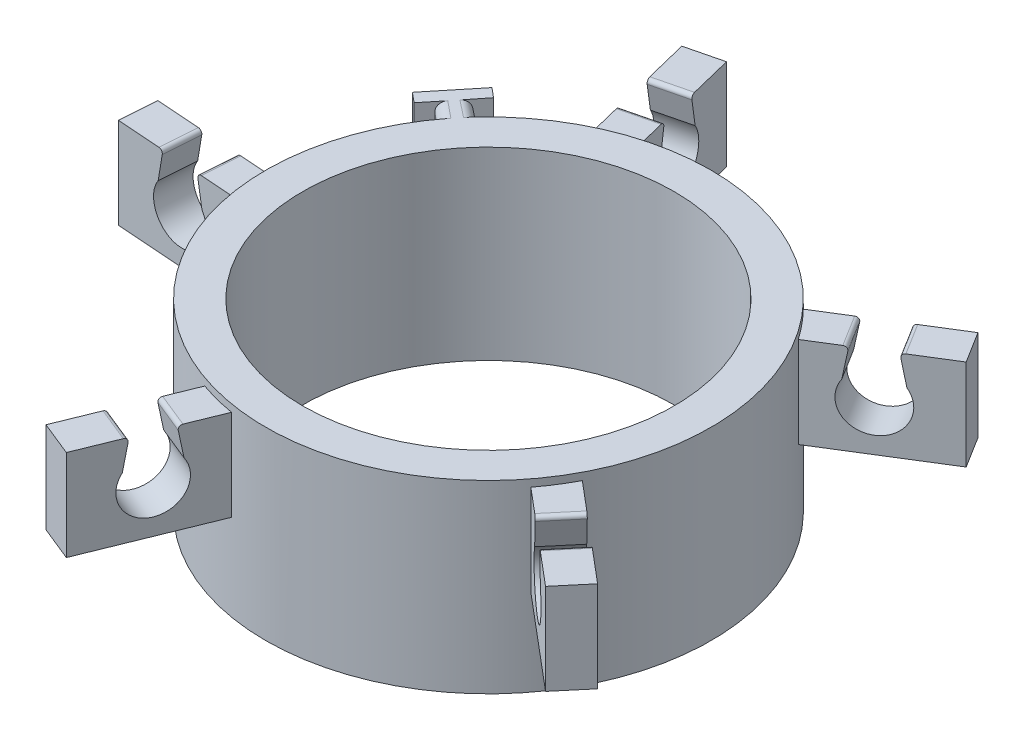
from build123d import *

# Parameters (mm, degrees)
ESQUISSE1_R                      = 12.05
ESQUISSE1_R_2                    = 10.05
BASE_DEPTH                       = 10
BOSS_TIGE_DEPTH                  = 2
CONGE_TIGE_R                     = 0.2
REP_SUPPORT_TIGE_COUNT           = 5
CONGE_TIGE_OF_REP_SUPPORT_TIGE_R = 0.2
BOSS_EXTRU_1_DEPTH               = 3
CONG_1_R                         = 0.5


with BuildPart() as part:
    # Esquisse1 → BASE (new body)
    with BuildSketch(Plane(origin=(0, 0, 0), x_dir=(1, 0, 0), z_dir=(0, 1, 0))):
        Circle(ESQUISSE1_R)
        Circle(ESQUISSE1_R_2, mode=Mode.SUBTRACT)
    extrude(amount=BASE_DEPTH)

    # Esquisse7 → BOSS TIGE (add)
    with BuildSketch(Plane(origin=(-2.523980967, 0, 0.624115435), x_dir=(-0.2400443980205285, -8.560907231219602e-15, -0.9707619105522024), z_dir=(0.9707619105522023, 0, -0.24004439802052846))):
        with BuildLine():
            Line((14.022631891, 9.608391049), (11.415742159, 9.608391049))
            Line((11.415742159, 9.608391049), (11.415742159, 4.685414017))
            Line((11.415742159, 4.685414017), (18.629521623, 4.685414017))
            Line((18.629521623, 4.685414017), (18.629521623, 9.608391049))
            Line((18.629521623, 9.608391049), (16.022631891, 9.608391049))
            Line((16.022631891, 9.608391049), (16.302913172, 8.020618644))
            ThreePointArc((16.302913172, 8.020618644), (15.022631891, 5.596902533), (13.742350611, 8.020618644))
            Line((13.742350611, 8.020618644), (14.022631891, 9.608391049))
        make_face()
    boss_tige = extrude(amount=BOSS_TIGE_DEPTH)

    # CONGE TIGE
    conge_tige_edges = [part.edges().sort_by_distance(p)[0] for p in [
        (-5.399362084, 9.608391049, -15.17008971),
        (-4.919273288, 9.608391049, -13.228565889),
    ]]
    fillet(conge_tige_edges, radius=CONGE_TIGE_R)

    # REP SUPPORT TIGE: BOSS TIGE ×5 about axis
    rep_support_tige_axis = Axis((0, 10, 0), (0, -1, 0))
    for i in range(1, REP_SUPPORT_TIGE_COUNT):
        add(boss_tige.rotate(rep_support_tige_axis, i * 360 / REP_SUPPORT_TIGE_COUNT))

    # CONGE TIGE of REP SUPPORT TIGE
    conge_tige_of_rep_support_tige_edges = [part.edges().sort_by_distance(p)[0] for p in [
        (12.759118029, 9.608391049, -9.82291402),
        (11.060974744, 9.608391049, -8.766358587),
        (13.284930692, 9.608391049, 9.099194977),
        (11.755331628, 9.608391049, 7.810658325),
        (-4.548579323, 9.608391049, 15.446525786),
        (-3.795780249, 9.608391049, 13.593610906),
        (-16.096107314, 9.608391049, 0.447282967),
        (-14.101252836, 9.608391049, 0.590655245),
    ]]
    fillet(conge_tige_of_rep_support_tige_edges, radius=CONGE_TIGE_OF_REP_SUPPORT_TIGE_R)

    # Esquisse8 → Boss.-Extru.1 (add)
    with BuildSketch(Plane(origin=(0, 10, 0), x_dir=(1, 0, 0), z_dir=(0, 1, 0))):
        with BuildLine():
            Line((-8.268421395, 8.757415667), (-7.703456323, 8.300627196))
            ThreePointArc((-7.703456323, 8.300627196), (-8.759173713, 7.17778009), (-9.652653966, 5.92198637))
            Line((-9.652653966, 5.92198637), (-10.190441919, 6.359674812))
            Line((-10.190441919, 6.359674812), (-9.690340196, 6.974149988))
            Line((-9.690340196, 6.974149988), (-10.694246531, 7.791197297))
            Line((-10.694246531, 7.791197297), (-11.194348255, 7.176722121))
            Line((-11.194348255, 7.176722121), (-11.732136208, 7.614410563))
            Line((-11.732136208, 7.614410563), (-9.79837654, 9.990421794))
            Line((-9.79837654, 9.990421794), (-9.28435206, 9.559462499))
            Line((-9.28435206, 9.559462499), (-9.775272229, 8.937627422))
            Line((-9.775272229, 8.937627422), (-8.759341564, 8.13558059))
            Line((-8.759341564, 8.13558059), (-8.268421395, 8.757415667))
        make_face()
    extrude(amount=-BOSS_EXTRU_1_DEPTH)

    # Congé1
    cong_1_edges = [part.edges().sort_by_distance(p)[0] for p in [
        (-10.235385675, 7, -7.417745099),
        (-9.304844667, 7, -8.566238952),
        (-9.304844667, 10, -8.566238952),
        (-10.235385675, 10, -7.417745099),
    ]]
    fillet(cong_1_edges, radius=CONG_1_R)


solid = part.part
